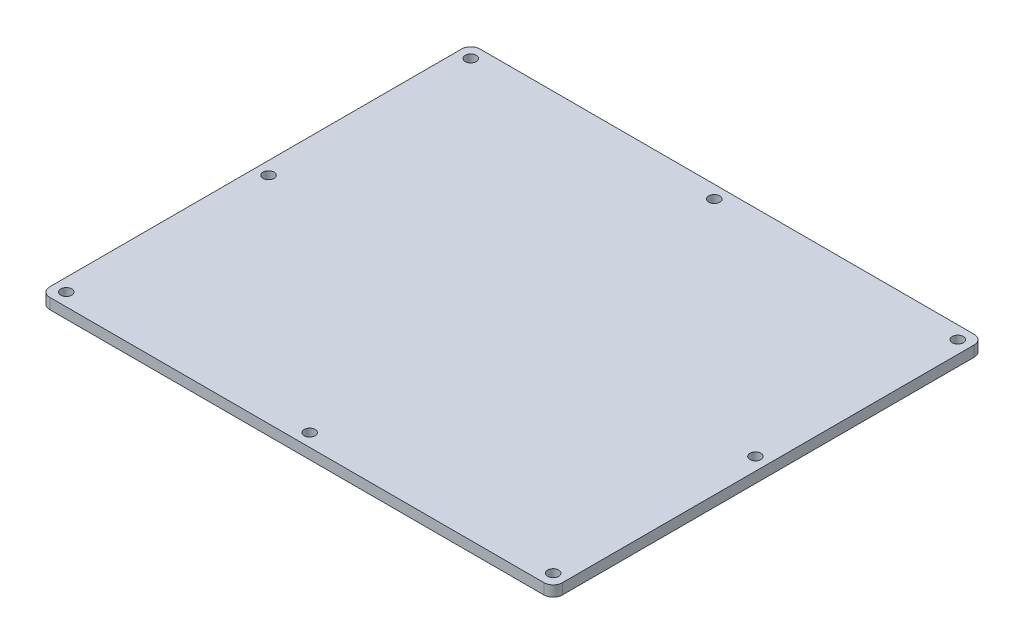
from build123d import *

# Parameters (mm, degrees)
SKETCH1_R           = 3
BOSS_EXTRUDE1_DEPTH = 5.842


with BuildPart() as part:
    # Sketch1 → Boss-Extrude1 (new body)
    with BuildSketch(Plane(origin=(0, 0, 0), x_dir=(1, 0, 0), z_dir=(0, 1, 0))):
        with BuildLine():
            Line((-2, 228), (268, 228))
            ThreePointArc((268, 228), (271.535533906, 226.535533906), (273, 223))
            Line((273, 223), (273, -2))
            ThreePointArc((273, -2), (271.535533906, -5.535533906), (268, -7))
            Line((268, -7), (-2, -7))
            ThreePointArc((-2, -7), (-5.535533906, -5.535533906), (-7, -2))
            Line((-7, -2), (-7, 223))
            ThreePointArc((-7, 223), (-5.535533906, 226.535533906), (-2, 228))
        make_face()
        with Locations(Location((0, 221, 0), (0, 0, 270))):
            Circle(SKETCH1_R, mode=Mode.SUBTRACT)
        with Locations(Location((266, 221, 0), (0, 0, 270))):
            Circle(SKETCH1_R, mode=Mode.SUBTRACT)
        with Locations(Location((266, 110.5, 0), (0, 0, 270))):
            Circle(SKETCH1_R, mode=Mode.SUBTRACT)
        with Locations(Location((0, 110.5, 0), (0, 0, 270))):
            Circle(SKETCH1_R, mode=Mode.SUBTRACT)
        with Locations(Location((133, 221, 0), (0, 0, 270))):
            Circle(SKETCH1_R, mode=Mode.SUBTRACT)
        with Locations(Location((133, 0, 0), (0, 0, 270))):
            Circle(SKETCH1_R, mode=Mode.SUBTRACT)
        with Locations(Location((266, 0, 0), (0, 0, 270))):
            Circle(SKETCH1_R, mode=Mode.SUBTRACT)
        with Locations(Location((0, 0, 0), (0, 0, 270))):
            Circle(SKETCH1_R, mode=Mode.SUBTRACT)
    extrude(amount=BOSS_EXTRUDE1_DEPTH)


solid = part.part
